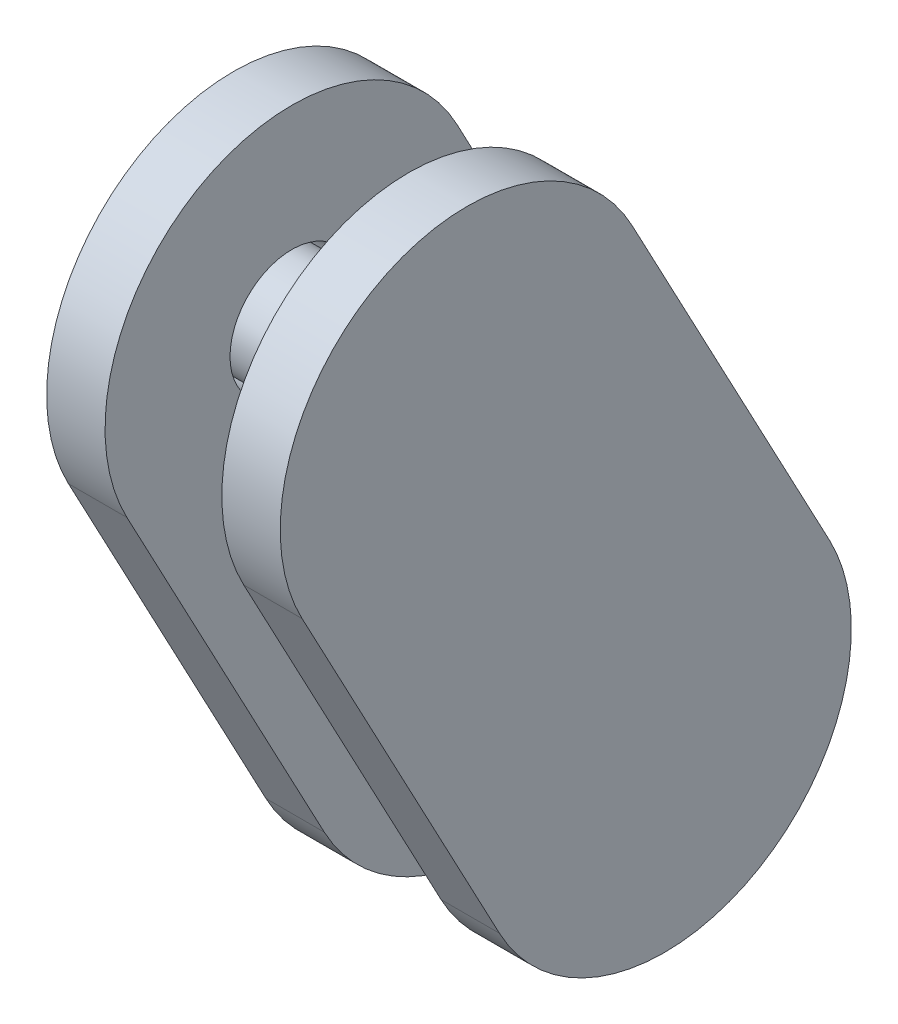
from build123d import *

# Parameters (mm, degrees)
BOSS_EXTRUDE1_DEPTH = 2.5
SKETCH2_R           = 2.35
BOSS_EXTRUDE2_DEPTH = 7.5
SKETCH3_R           = 2.65
BOSS_EXTRUDE3_DEPTH = 2.5


with BuildPart() as part:
    # Sketch1 → Boss-Extrude1 (new body)
    with BuildSketch(Plane(origin=(23.504809472, 0, 0), x_dir=(0, 0, -1), z_dir=(1, 0, 0))):
        with BuildLine():
            Line((-1.032603934, 120.437046334), (7.417884196, 104.543989663))
            ThreePointArc((7.417884196, 104.543989663), (4.110075956, 93.724636418), (-6.709277289, 97.032444658))
            Line((-6.709277289, 97.032444658), (-15.15976542, 112.92550133))
            ThreePointArc((-15.15976542, 112.92550133), (-11.851957179, 123.744854575), (-1.032603934, 120.437046334))
        make_face()
    extrude(amount=BOSS_EXTRUDE1_DEPTH)

    # Sketch2 → Boss-Extrude2 (add)
    with BuildSketch(Plane.ZY.offset(-23.504809472)):
        with Locations(Location((8.096184677, 116.681273832, 0), (0, 0, 180))):
            Circle(SKETCH2_R)
        with Locations(Location((-0.354303453, 100.78821716, 0), (0, 0, 180))):
            Circle(SKETCH2_R)
    extrude(amount=BOSS_EXTRUDE2_DEPTH)


with BuildPart() as body_2:
    # Sketch3 → Boss-Extrude3 (new body)
    with BuildSketch(Plane.ZY.offset(-18.504809472)):
        with BuildLine():
            Line((1.032603934, 120.437046334), (-7.417884196, 104.543989663))
            ThreePointArc((-7.417884196, 104.543989663), (-4.110075956, 93.724636418), (6.709277289, 97.032444658))
            Line((6.709277289, 97.032444658), (15.15976542, 112.92550133))
            ThreePointArc((15.15976542, 112.92550133), (11.851957179, 123.744854575), (1.032603934, 120.437046334))
        make_face()
        with Locations((8.096184677, 116.681273832)):
            Circle(SKETCH3_R, mode=Mode.SUBTRACT)
        with Locations((-0.354303453, 100.78821716)):
            Circle(SKETCH3_R, mode=Mode.SUBTRACT)
    extrude(amount=BOSS_EXTRUDE3_DEPTH)


with BuildPart() as part_1:
    # Body-Move/Copy1: moved
    add(part.part.moved(Location((-21, -116.68, -8.1))))


with BuildPart() as body_2_1:
    # Body-Move/Copy1: moved
    add(body_2.part.moved(Location((-21, -116.68, -8.1))))


solid = Compound([part_1.part, body_2_1.part])
